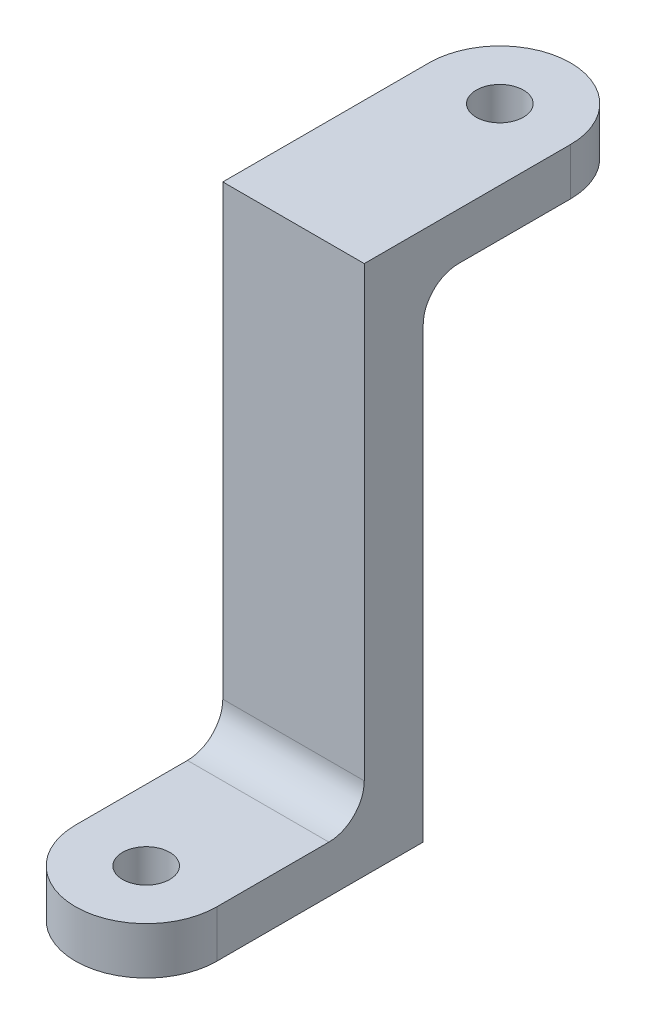
from build123d import *

# Parameters (mm, degrees)
SKETCH1_R                      = 2
BOSS_EXTRUDE1_DEPTH            = 4
SKETCH2_W                      = 12
SKETCH2_H                      = 5
BOSS_EXTRUDE2_DEPTH            = 37
SKETCH3_R                      = 2
SKETCH3_W                      = 12
SKETCH3_H                      = 5
BOSS_EXTRUDE3_DEPTH            = 4
FILLET1_R                      = 3
CUT_EXTRUDE1_REACH             = 56.891
SKETCH4_W                      = 12
SKETCH4_H                      = 19.420745895
CUT_EXTRUDE1_DIRECTION_2_DEPTH = 10


with BuildPart() as part:
    # Sketch1 → Boss-Extrude1 (new body)
    with BuildSketch(Plane(origin=(0, 0, 0), x_dir=(1, 0, 0), z_dir=(0, 1, 0))):
        with BuildLine():
            ThreePointArc((6, 30), (0, 36), (-6, 30))
            Line((-6, 30), (-6, 0))
            ThreePointArc((-6, 0), (0, -6), (6, 0))
            Line((6, 0), (6, 30))
        make_face()
        with Locations(Location((0, 30, 0), (0, 0, 270))):
            Circle(SKETCH1_R, mode=Mode.SUBTRACT)
        with Locations(Location((0, 0, 0), (0, 0, 270))):
            Circle(SKETCH1_R, mode=Mode.SUBTRACT)
    extrude(amount=BOSS_EXTRUDE1_DEPTH)

    # Sketch2 → Boss-Extrude2 (add)
    with BuildSketch(Plane(origin=(0, 4, 0), x_dir=(1, 0, 0), z_dir=(0, 1, 0))):
        with Locations((0, 15)):
            Rectangle(SKETCH2_W, SKETCH2_H)
    extrude(amount=BOSS_EXTRUDE2_DEPTH)

    # Sketch3 → Boss-Extrude3 (add)
    # profile 1 of 2: a face of its own
    with BuildSketch(Plane(origin=(0, 41, 0), x_dir=(1, 0, 0), z_dir=(0, 1, 0))):
        with BuildLine():
            Line((6, 17.5), (6, 30))
            ThreePointArc((6, 30), (0, 36), (-6, 30))
            Line((-6, 30), (-6, 17.5))
            Line((-6, 17.5), (6, 17.5))
        make_face()
        with Locations(Location((0, 30, 0), (0, 0, 270))):
            Circle(SKETCH3_R, mode=Mode.SUBTRACT)
    # profile 2 of 2: a face of its own
    with BuildSketch(Plane(origin=(0, 41, 0), x_dir=(1, 0, 0), z_dir=(0, 1, 0))):
        with Locations((0, 15)):
            Rectangle(SKETCH3_W, SKETCH3_H)
    extrude(amount=BOSS_EXTRUDE3_DEPTH)

    # Fillet1
    fillet1_edges = [part.edges().sort_by_distance(p)[0] for p in [
        (0, 4, -17.5),
        (0, 41, -17.5),
        (0, 4, -12.5),
    ]]
    fillet(fillet1_edges, radius=FILLET1_R)

    # Sketch4 → Cut-Extrude1 (cut, up to next)
    with BuildSketch(Plane(origin=(0, 4, 0), x_dir=(1, 0, 0), z_dir=(0, 1, 0)), mode=Mode.PRIVATE) as cut_extrude1_sk1:
        with Locations((0, 27.210372948)):
            Rectangle(SKETCH4_W, SKETCH4_H)
    cut_extrude1_tool1 = extrude(cut_extrude1_sk1.sketch, amount=-CUT_EXTRUDE1_REACH, mode=Mode.PRIVATE) & part.part
    add(cut_extrude1_tool1.solids().sort_by_distance((0, 4, -27.210373))[0], mode=Mode.SUBTRACT)

    # Sketch4 → Cut-Extrude1 direction 2 (cut)
    with BuildSketch(Plane(origin=(0, 4, 0), x_dir=(1, 0, 0), z_dir=(0, 1, 0))):
        with Locations((0, 27.210372948)):
            Rectangle(SKETCH4_W, SKETCH4_H)
    extrude(amount=CUT_EXTRUDE1_DIRECTION_2_DEPTH, mode=Mode.SUBTRACT)


solid = part.part
